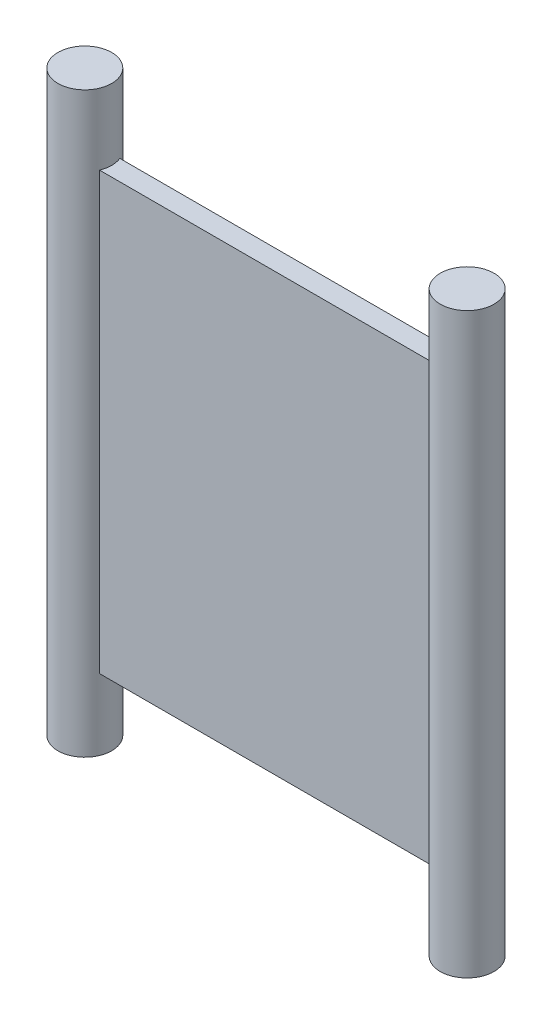
from build123d import *

# Parameters (mm, degrees)
SKETCH1_W           = 18.852
SKETCH1_H           = 1
BOSS_EXTRUDE1_DEPTH = 21.5
SKETCH2_R           = 1.325
BOSS_EXTRUDE2_DEPTH = 14.25


with BuildPart() as part:
    # Sketch1 → Boss-Extrude1 (new body)
    with BuildSketch(Plane(origin=(0, 0, 0), x_dir=(1, 0, 0), z_dir=(0, 1, 0))):
        Rectangle(SKETCH1_W, SKETCH1_H)
    extrude(amount=BOSS_EXTRUDE1_DEPTH)

    # Sketch2 → Boss-Extrude2 (add, symmetric)
    with BuildSketch(Plane(origin=(0, 10.75, 0), x_dir=(1, 0, 0), z_dir=(0, 1, 0))):
        with Locations(Location((-9.426, 0, 0), (0, 0, 270))):
            Circle(SKETCH2_R)
        with Locations(Location((9.426, 0, 0), (0, 0, 270))):
            Circle(SKETCH2_R)
    extrude(amount=BOSS_EXTRUDE2_DEPTH, both=True)


solid = part.part
